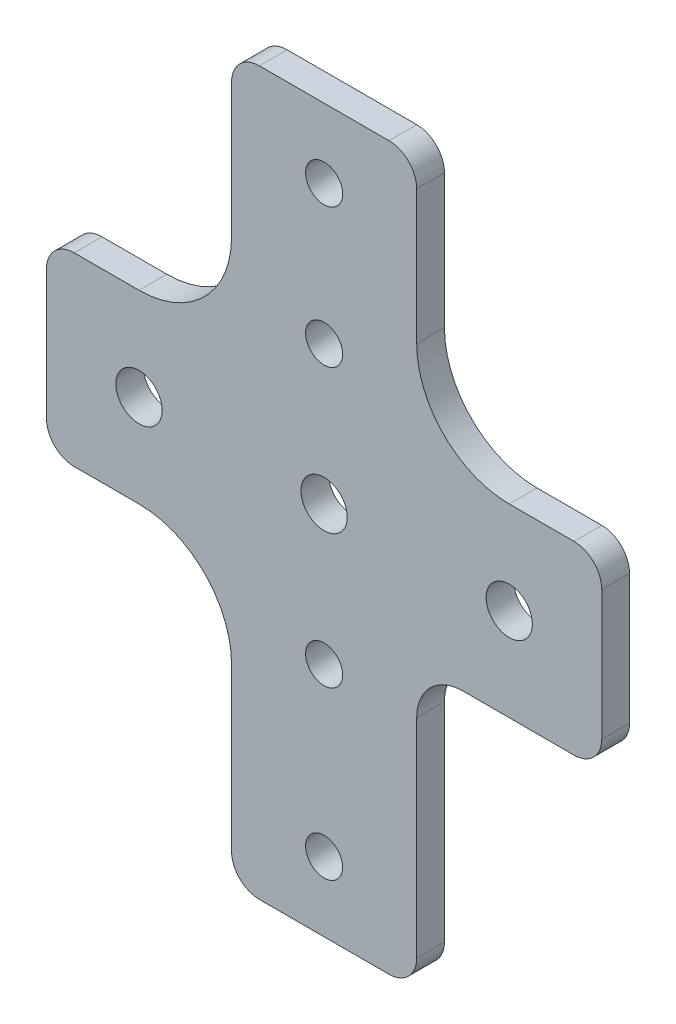
from build123d import *

# Parameters (mm, degrees)
EXTRUDE_1_DEPTH     = 3
SKETCH_3_W          = 20
SKETCH_3_H          = 3
EXTRUDE_2_DEPTH     = 3
FILLET_1_R          = 10
FILLET_2_R          = 3
SKETCH_2_R          = 2
CUT_EXTRUDE_1_DEPTH = 51.490098039
SKETCH_4_R          = 2.5
CUT_EXTRUDE_2_DEPTH = 51.490098039
FILLET_3_R          = 5


with BuildPart() as part:
    # 草图1 → 凸台-拉伸1 (new body)
    with BuildSketch(Plane.XY):
        Polygon((-30, -10), (-30, 10), (-10, 10), (-10, 37.5), (10, 37.5), (10, 10), (30, 10), (30, -10), (10, -10), (10, -37.5), (-10, -37.5), (-10, -10), align=None)
    extrude(amount=EXTRUDE_1_DEPTH)

    # 草图3 → 凸台-拉伸2 (add)
    with BuildSketch(Plane.XY.offset(3)):
        with Locations((0, -39)):
            Rectangle(SKETCH_3_W, SKETCH_3_H)
    extrude(amount=-EXTRUDE_2_DEPTH)

    # 圆角1
    fillet_1_edges = [part.edges().sort_by_distance(p)[0] for p in [
        (-10, 10, 1.5),
        (10, 10, 1.5),
        (-10, -10, 1.5),
    ]]
    fillet(fillet_1_edges, radius=FILLET_1_R)

    # 圆角2
    fillet_2_edges = [part.edges().sort_by_distance(p)[0] for p in [
        (-10, 37.5, 1.5),
        (10, 37.5, 1.5),
        (30, 10, 1.5),
        (30, -10, 1.5),
        (-30, -10, 1.5),
        (-30, 10, 1.5),
        (-10, -40.5, 1.5),
        (10, -40.5, 1.5),
    ]]
    fillet(fillet_2_edges, radius=FILLET_2_R)

    # 草图2 → 切除-拉伸1 (cut, through all)
    with BuildSketch(Plane.XY.offset(3)):
        with Locations((0, 30)):
            Circle(SKETCH_2_R)
        with Locations((0, 15)):
            Circle(SKETCH_2_R)
        with Locations((0, -15)):
            Circle(SKETCH_2_R)
        with Locations((0, -33)):
            Circle(SKETCH_2_R)
    extrude(amount=-CUT_EXTRUDE_1_DEPTH, mode=Mode.SUBTRACT)

    # 草图4 → 切除-拉伸2 (cut, through all)
    with BuildSketch(Plane.XY.offset(3)):
        with Locations((-20, 0)):
            Circle(SKETCH_4_R)
        Circle(SKETCH_4_R)
        with Locations(Location((20, 0, 0), (0, 0, 180))):
            Circle(SKETCH_4_R)
    extrude(amount=-CUT_EXTRUDE_2_DEPTH, mode=Mode.SUBTRACT)

    # 圆角3
    fillet_3_edges = [part.edges().sort_by_distance(p)[0] for p in [
        (10, -10, 1.5),
    ]]
    fillet(fillet_3_edges, radius=FILLET_3_R)


solid = part.part
